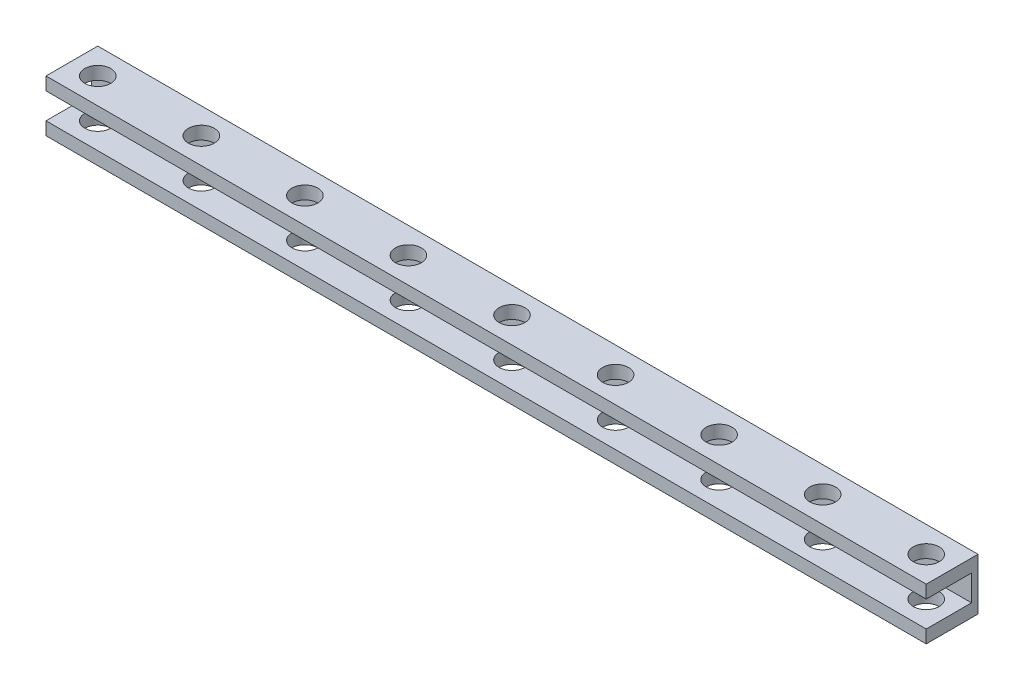
from build123d import *

# Parameters (mm, degrees)
SKETCH1_W           = 136
SKETCH1_H           = 8
BOSS_EXTRUDE1_DEPTH = 8
SKETCH2_W           = 7
SKETCH2_H           = 4
CUT_EXTRUDE1_DEPTH  = 142
SKETCH3_R           = 2
CUT_EXTRUDE2_DEPTH  = 142


with BuildPart() as part:
    # Sketch1 → Boss-Extrude1 (new body)
    with BuildSketch(Plane(origin=(0, 0, 0), x_dir=(1, 0, 0), z_dir=(0, 1, 0))):
        with Locations((-1.696732132, 28.439939714)):
            Rectangle(SKETCH1_W, SKETCH1_H)
    extrude(amount=BOSS_EXTRUDE1_DEPTH)

    # Sketch2 → Cut-Extrude1 (cut)
    with BuildSketch(Plane.ZY.offset(69.696732132)):
        with Locations((-27.939939714, 4)):
            Rectangle(SKETCH2_W, SKETCH2_H)
    extrude(amount=-CUT_EXTRUDE1_DEPTH, mode=Mode.SUBTRACT)

    # Sketch3 → Cut-Extrude2 (cut)
    with BuildSketch(Plane(origin=(0, 8, 0), x_dir=(1, 0, 0), z_dir=(0, 1, 0))):
        with Locations(Location((-65.696732132, 28.439939714, 0), (0, 0, 270))):
            Circle(SKETCH3_R)
        with Locations(Location((-49.696732132, 28.439939714, 0), (0, 0, 270))):
            Circle(SKETCH3_R)
        with Locations(Location((-33.696732132, 28.439939714, 0), (0, 0, 270))):
            Circle(SKETCH3_R)
        with Locations(Location((-17.696732132, 28.439939714, 0), (0, 0, 270))):
            Circle(SKETCH3_R)
        with Locations(Location((-1.696732132, 28.439939714, 0), (0, 0, 270))):
            Circle(SKETCH3_R)
        with Locations(Location((14.303267868, 28.439939714, 0), (0, 0, 270))):
            Circle(SKETCH3_R)
        with Locations(Location((30.303267868, 28.439939714, 0), (0, 0, 270))):
            Circle(SKETCH3_R)
        with Locations(Location((46.303267868, 28.439939714, 0), (0, 0, 270))):
            Circle(SKETCH3_R)
        with Locations(Location((62.303267868, 28.439939714, 0), (0, 0, 270))):
            Circle(SKETCH3_R)
    extrude(amount=-CUT_EXTRUDE2_DEPTH, mode=Mode.SUBTRACT)


solid = part.part
